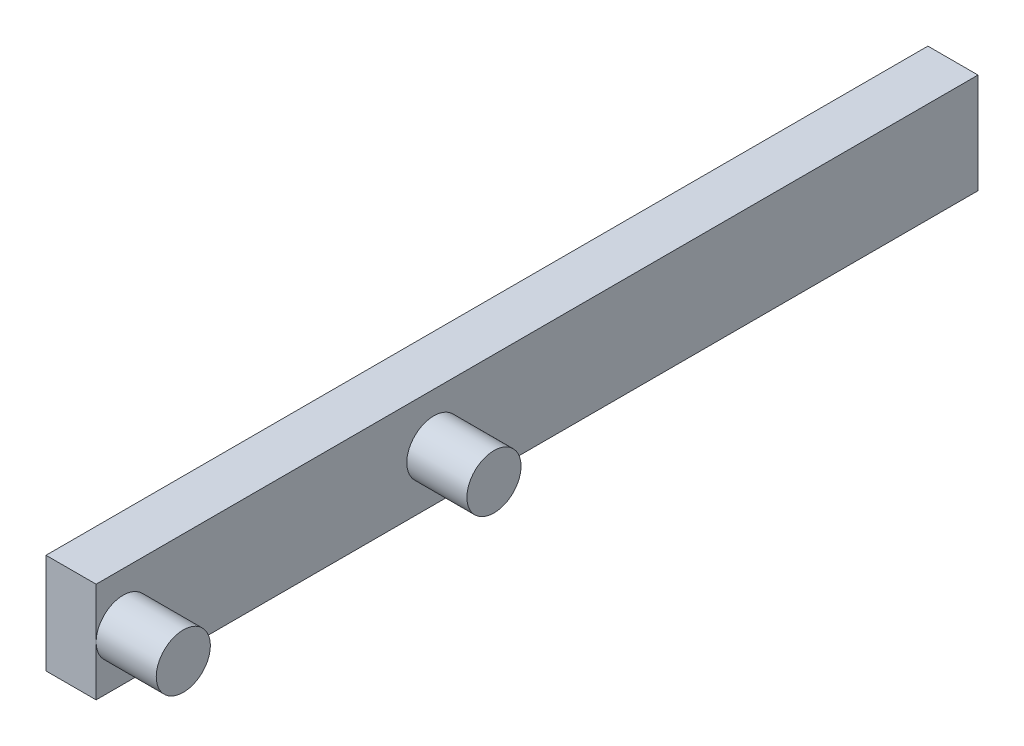
from build123d import *

# Parameters (mm, degrees)
SKETCH1_W           = 44
SKETCH1_H           = 5
BOSS_EXTRUDE1_DEPTH = 2.5
SKETCH2_R           = 1.35
BOSS_EXTRUDE2_DEPTH = 3


with BuildPart() as part:
    # Sketch1 → Boss-Extrude1 (new body)
    with BuildSketch(Plane(origin=(0, 0, 0), x_dir=(0, 0, -1), z_dir=(1, 0, 0))):
        Rectangle(SKETCH1_W, SKETCH1_H)
    extrude(amount=BOSS_EXTRUDE1_DEPTH)

    # Sketch2 → Boss-Extrude2 (add)
    with BuildSketch(Plane(origin=(2.5, 0, 0), x_dir=(0, 0, -1), z_dir=(1, 0, 0))):
        with Locations(Location((-20.65, 0, 0), (0, 0, 180))):
            Circle(SKETCH2_R)
        with Locations((-5.15, 0)):
            Circle(SKETCH2_R)
    extrude(amount=BOSS_EXTRUDE2_DEPTH)


solid = part.part
